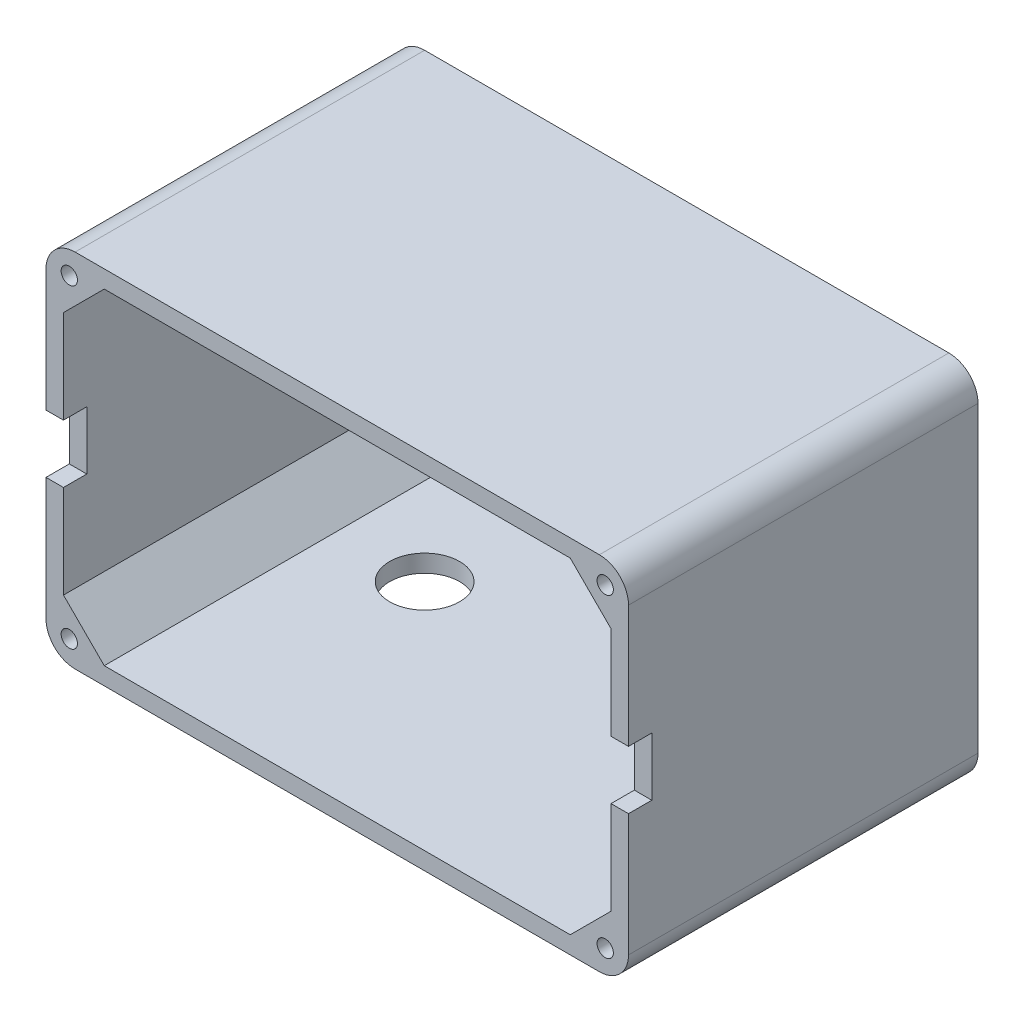
from build123d import *

# Parameters (mm, degrees)
EXTRUDE_1_DEPTH          = 60
EXTRUDE_2_DEPTH          = 60
SKETCH_4_R               = 1.4
CUT_EXTRUDE_1_DEPTH      = 60
MIRROR_2_COPY_1_DEPTH    = 60
MIRROR_2_COPY_2_SKETCH_R = 1.4
MIRROR_2_COPY_2_DEPTH    = 60
SKETCH_7_R               = 6
CUT_EXTRUDE_3_DEPTH      = 10
SKETCH_8_W               = 4
SKETCH_8_H               = 10
CUT_EXTRUDE_4_DEPTH      = 100


with BuildPart() as part:
    # 草图1 → 凸台-拉伸1 (new body)
    with BuildSketch(Plane.XY):
        with BuildLine():
            Line((-45, 31), (45, 31))
            ThreePointArc((45, 31), (48.535533906, 29.535533906), (50, 26))
            Line((50, 26), (50, -26))
            ThreePointArc((50, -26), (48.535533906, -29.535533906), (45, -31))
            Line((45, -31), (-45, -31))
            ThreePointArc((-45, -31), (-48.535533906, -29.535533906), (-50, -26))
            Line((-50, -26), (-50, 26))
            ThreePointArc((-50, 26), (-48.535533906, 29.535533906), (-45, 31))
        make_face()
        with BuildLine():
            Line((-42, 28), (42, 28))
            ThreePointArc((42, 28), (45.535533906, 26.535533906), (47, 23))
            Line((47, 23), (47, -23))
            ThreePointArc((47, -23), (45.535533906, -26.535533906), (42, -28))
            Line((42, -28), (-42, -28))
            ThreePointArc((-42, -28), (-45.535533906, -26.535533906), (-47, -23))
            Line((-47, -23), (-47, 23))
            ThreePointArc((-47, 23), (-45.535533906, 26.535533906), (-42, 28))
        make_face(mode=Mode.SUBTRACT)
    extrude(amount=EXTRUDE_1_DEPTH)

    # 草图3 → 凸台-拉伸2 (add)
    with BuildSketch(Plane.XY.offset(60)):
        Polygon((-47, 28), (-47, 21), (-40, 28), align=None)
    extrude_2 = extrude(amount=-EXTRUDE_2_DEPTH)

    # 草图4 → 切除-拉伸1 (cut)
    with BuildSketch(Plane.XY.offset(60)):
        with Locations((-46, 27)):
            Circle(SKETCH_4_R)
    cut_extrude_1 = extrude(amount=-CUT_EXTRUDE_1_DEPTH, mode=Mode.SUBTRACT)

    # 镜向1: 凸台-拉伸2, 切除-拉伸1 across plane
    add(extrude_2.mirror(Plane(origin=(0, 0, 0), x_dir=(0, 0, 1), z_dir=(1, 0, 0))))
    add(cut_extrude_1.mirror(Plane(origin=(0, 0, 0), x_dir=(0, 0, 1), z_dir=(1, 0, 0))), mode=Mode.SUBTRACT)

    # 镜向2: 凸台-拉伸2, 切除-拉伸1 across plane
    add(extrude_2.mirror(Plane.ZX))
    add(cut_extrude_1.mirror(Plane.ZX), mode=Mode.SUBTRACT)

    # 镜向2 copy 1 sketch → 镜向2 copy 1 (add)
    with BuildSketch(Plane(origin=(0, 0, 60), x_dir=(-1, 0, 0), z_dir=(0, 0, 1))):
        Polygon((-47, 28), (-47, 21), (-40, 28), align=None)
    extrude(amount=-MIRROR_2_COPY_1_DEPTH)

    # 镜向2 copy 2 sketch → 镜向2 copy 2 (cut)
    with BuildSketch(Plane(origin=(0, 0, 60), x_dir=(-1, 0, 0), z_dir=(0, 0, 1))):
        with Locations((-46, 27)):
            Circle(MIRROR_2_COPY_2_SKETCH_R)
    extrude(amount=-MIRROR_2_COPY_2_DEPTH, mode=Mode.SUBTRACT)

    # 草图7 → 切除-拉伸3 (cut)
    with BuildSketch(Plane.XZ.offset(31)):
        with Locations(Location((-25, 20, 0), (0, 0, 270))):
            Circle(SKETCH_7_R)
        with Locations(Location((25, 20, 0), (0, 0, 270))):
            Circle(SKETCH_7_R)
    extrude(amount=-CUT_EXTRUDE_3_DEPTH, mode=Mode.SUBTRACT)

    # 草图8 → 切除-拉伸4 (cut)
    with BuildSketch(Plane(origin=(50, 0, 0), x_dir=(0, 0, -1), z_dir=(1, 0, 0))):
        with Locations((-58, 0)):
            Rectangle(SKETCH_8_W, SKETCH_8_H)
    extrude(amount=-CUT_EXTRUDE_4_DEPTH, mode=Mode.SUBTRACT)


solid = part.part
